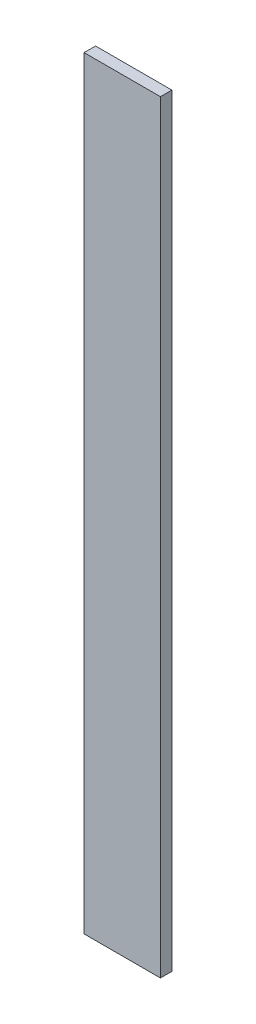
from build123d import *

# Parameters (mm, degrees)
SKETCH1_W           = 40
SKETCH1_H           = 400
BOSS_EXTRUDE1_DEPTH = 6


with BuildPart() as part:
    # Sketch1 → Boss-Extrude1 (new body)
    with BuildSketch(Plane.XY):
        with Locations((-36.551724138, 97.75862069)):
            Rectangle(SKETCH1_W, SKETCH1_H)
    extrude(amount=BOSS_EXTRUDE1_DEPTH)


solid = part.part
